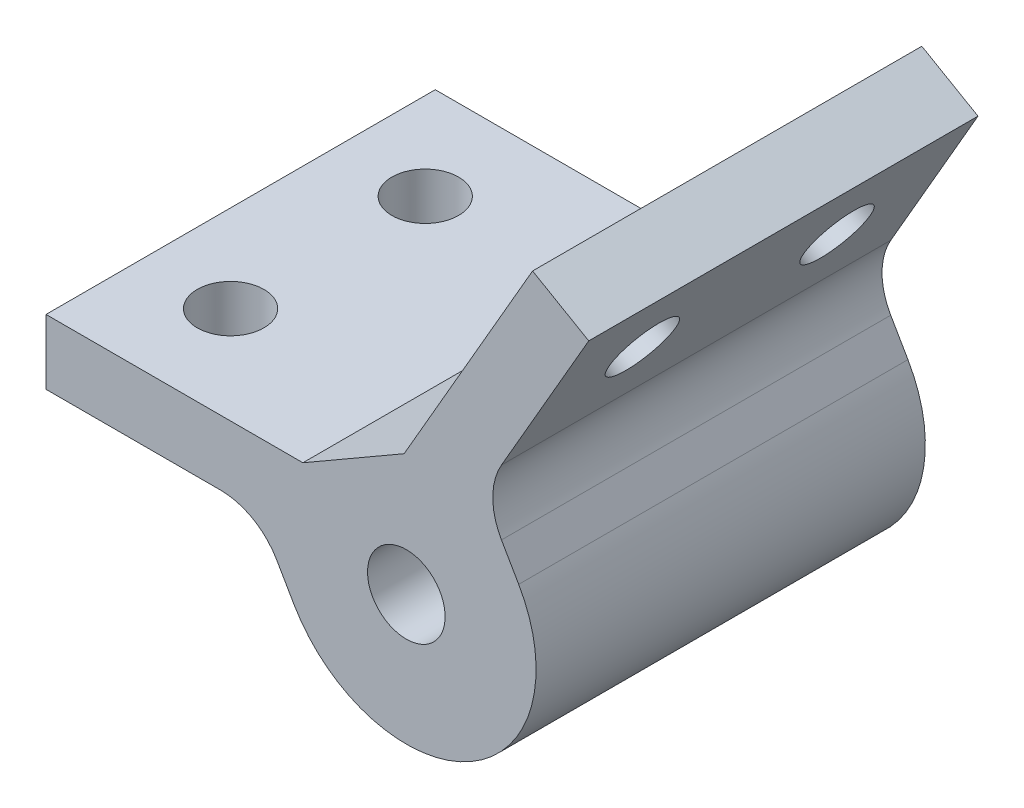
from build123d import *

# Parameters (mm, degrees)
BOSS_EXTRUDE1_DEPTH     = 19.05
F_6_CLEARANCE_HOLE1_D   = 3.7973
FILLET1_R               = 3.175
E_0_25_DIAMETER_HOLE1_D = 3.2639
E_0_25_DIAMETER_HOLE2_D = 3.2639


with BuildPart() as part:
    # Sketch1 → Boss-Extrude1 (new body)
    with BuildSketch(Plane.XY):
        with BuildLine():
            Line((-0.10876362, 5.907615883), (6.17773638, 16.796153285))
            Line((6.17773638, 16.796153285), (8.927367037, 15.208653285))
            Line((8.927367037, 15.208653285), (3.739497694, 6.223))
            Line((3.739497694, 6.223), (5.499261314, 3.175))
            ThreePointArc((5.499261314, 3.175), (3.175, -5.499261314), (-5.499261314, -3.175))
            Line((-5.499261314, -3.175), (-7.259024935, -0.127))
            Line((-7.259024935, -0.127), (-17.63476362, -0.127))
            Line((-17.63476362, -0.127), (-17.63476362, 3.048))
            Line((-17.63476362, 3.048), (-5.06176362, 3.048))
            Line((-5.06176362, 3.048), (-0.10876362, 5.907615883))
        make_face()
    extrude(amount=BOSS_EXTRUDE1_DEPTH)

    # #6 Clearance Hole1 (through all)
    with Locations(Plane(origin=(0, 0, 0), x_dir=(-1, 0, 0), z_dir=(0, 0, -1))):
        with Locations((0, 0)):
            Hole(F_6_CLEARANCE_HOLE1_D / 2)

    # Fillet1
    fillet1_edges = [part.edges().sort_by_distance(p)[0] for p in [
        (3.739497694, 6.223, 9.525),
        (-7.259024935, -0.127, 9.525),
    ]]
    fillet(fillet1_edges, radius=FILLET1_R)

    # E (0.25) Diameter Hole1 (through all)
    with Locations(Plane(origin=(0.109985226, -0.0635, 0), x_dir=(0, 0, -1), z_dir=(0.86602540378444, -0.49999999999999784, 0))):
        with Locations((-4.7625, 13.36343783), (-14.2875, 13.36343783)):
            Hole(E_0_25_DIAMETER_HOLE1_D / 2)

    # E (0.25) Diameter Hole2 (through all)
    with Locations(Plane(origin=(-13.36343783, -0.127, 14.2875), x_dir=(-1, 0, 0), z_dir=(0, -1, 0))):
        with Locations((0, 0), (0, 9.525)):
            Hole(E_0_25_DIAMETER_HOLE2_D / 2)


solid = part.part
